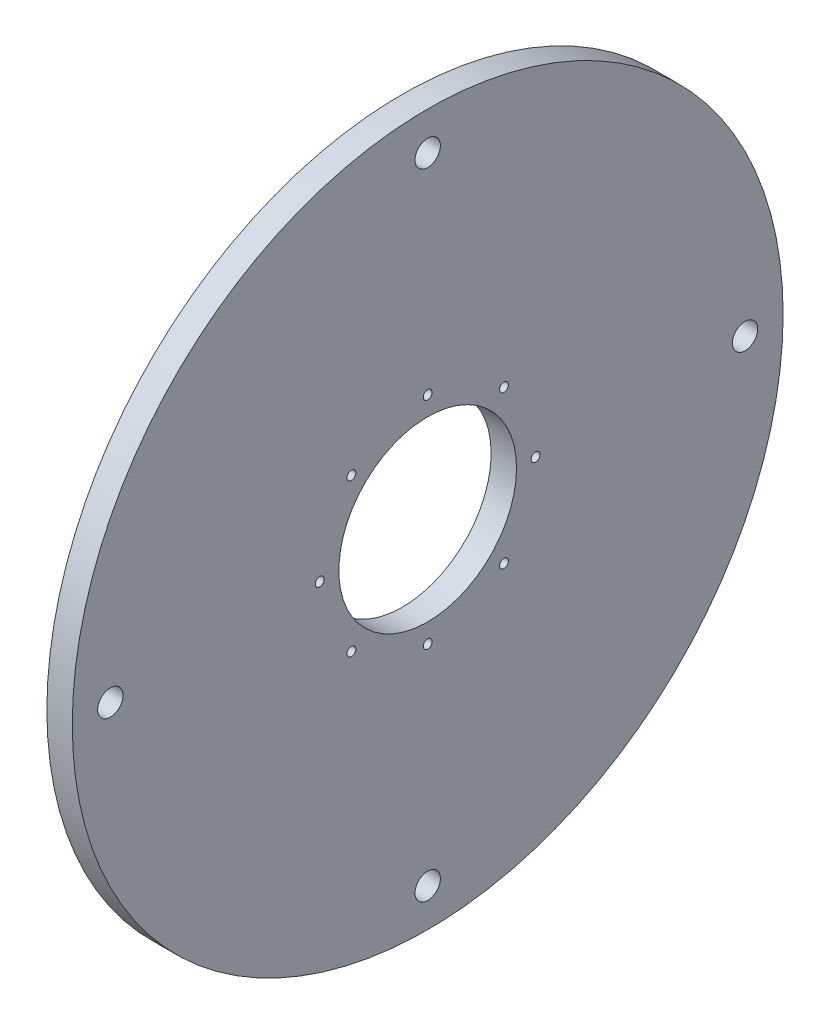
from build123d import *

# Parameters (mm, degrees)
SKETCH_1_R      = 140
SKETCH_1_R_2    = 35
SKETCH_1_R_3    = 1.75
SKETCH_1_R_4    = 5
EXTRUDE_1_DEPTH = 10


with BuildPart() as part:
    # 草图1 → 凸台-拉伸1 (new body)
    with BuildSketch(Plane(origin=(0, 0, 0), x_dir=(0, 0, -1), z_dir=(1, 0, 0))):
        with Locations((-24.920952127, 0.093336899)):
            Circle(SKETCH_1_R)
        with Locations((-24.920952127, 0.093336899)):
            Circle(SKETCH_1_R_2, mode=Mode.SUBTRACT)
        with Locations((-24.920952127, 42.593336899)):
            Circle(SKETCH_1_R_3, mode=Mode.SUBTRACT)
        with Locations((5.131086073, 30.1453751)):
            Circle(SKETCH_1_R_3, mode=Mode.SUBTRACT)
        with Locations((17.579047873, 0.093336899)):
            Circle(SKETCH_1_R_3, mode=Mode.SUBTRACT)
        with Locations((5.131086073, -29.958701301)):
            Circle(SKETCH_1_R_3, mode=Mode.SUBTRACT)
        with Locations((-24.920952127, -42.406663101)):
            Circle(SKETCH_1_R_3, mode=Mode.SUBTRACT)
        with Locations((-54.972990328, -29.958701301)):
            Circle(SKETCH_1_R_3, mode=Mode.SUBTRACT)
        with Locations((-67.420952127, 0.093336899)):
            Circle(SKETCH_1_R_3, mode=Mode.SUBTRACT)
        with Locations((-54.972990328, 30.1453751)):
            Circle(SKETCH_1_R_3, mode=Mode.SUBTRACT)
        with Locations((-149.920952127, 0.093336899)):
            Circle(SKETCH_1_R_4, mode=Mode.SUBTRACT)
        with Locations((-24.920952127, 125.093336899)):
            Circle(SKETCH_1_R_4, mode=Mode.SUBTRACT)
        with Locations((100.079047873, 0.093336899)):
            Circle(SKETCH_1_R_4, mode=Mode.SUBTRACT)
        with Locations((-24.920952127, -124.906663101)):
            Circle(SKETCH_1_R_4, mode=Mode.SUBTRACT)
    extrude(amount=EXTRUDE_1_DEPTH)


solid = part.part
